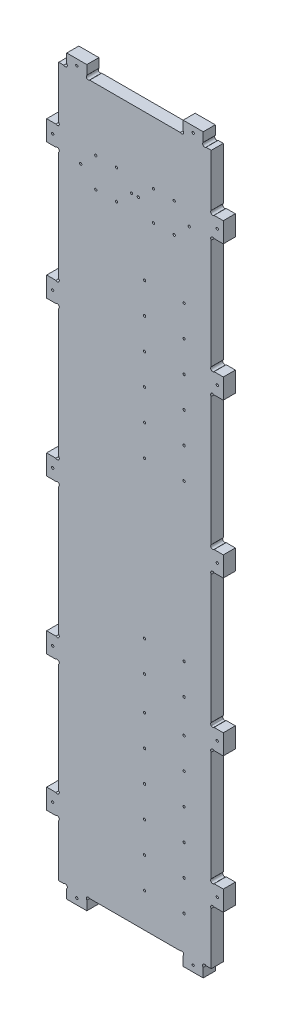
from build123d import *

# Parameters (mm, degrees)
SKETCH1_W            = 263.75
SKETCH1_H            = 1094.236516538
BOSS_EXTRUDE1_DEPTH  = 18
SKETCH2_W            = 18
SKETCH2_H            = 200
SKETCH2_H_2          = 172.118258269
CUT_EXTRUDE2_DEPTH   = 18
M3_CLEARANCE_HOLE1_D = 3.4
M3_CLEARANCE_HOLE2_D = 3.4
SKETCH7_R            = 3
CUT_EXTRUDE3_DEPTH   = 30


with BuildPart() as part:
    # Sketch1 → Boss-Extrude1 (new body)
    with BuildSketch(Plane.XY):
        with Locations((-43.875, 362.922706453)):
            Rectangle(SKETCH1_W, SKETCH1_H)
    extrude(amount=BOSS_EXTRUDE1_DEPTH)

    # Sketch2 → Cut-Extrude2 (cut)
    with BuildSketch(Plane(origin=(0, 0, 0), x_dir=(-1, 0, 0), z_dir=(0, 0, -1))):
        with Locations((166.75, 247.922706453)):
            Rectangle(SKETCH2_W, SKETCH2_H)
        Polygon((175.75, -184.195551816), (145.75, -184.195551816), (145.75, -166.195551816), (157.75, -166.195551816), (157.75, -84.195551816), (175.75, -84.195551816), align=None)
        Polygon((115.75, -166.195551816), (43.875, -166.195551816), (-28, -166.195551816), (-28, -184.195551816), (115.75, -184.195551816), align=None)
        with Locations((166.75, 31.863577318)):
            Rectangle(SKETCH2_W, SKETCH2_H_2)
        with Locations((-79, 247.922706453)):
            Rectangle(SKETCH2_W, SKETCH2_H)
        with Locations((-79, 31.863577318)):
            Rectangle(SKETCH2_W, SKETCH2_H_2)
        Polygon((-70, -84.195551816), (-88, -84.195551816), (-88, -184.195551816), (-58, -184.195551816), (-58, -166.195551816), (-70, -166.195551816), align=None)
        with Locations((-79, 477.922706453)):
            Rectangle(SKETCH2_W, SKETCH2_H)
        Polygon((-88, 910.040964722), (-58, 910.040964722), (-58, 892.040964722), (-70, 892.040964722), (-70, 810.040964722), (-88, 810.040964722), align=None)
        Polygon((-28, 892.040964722), (43.875, 892.040964722), (115.75, 892.040964722), (115.75, 910.040964722), (-28, 910.040964722), align=None)
        with Locations((-79, 693.981835587)):
            Rectangle(SKETCH2_W, SKETCH2_H_2)
        with Locations((166.75, 477.922706453)):
            Rectangle(SKETCH2_W, SKETCH2_H)
        with Locations((166.75, 693.981835587)):
            Rectangle(SKETCH2_W, SKETCH2_H_2)
        Polygon((157.75, 810.040964722), (175.75, 810.040964722), (175.75, 910.040964722), (145.75, 910.040964722), (145.75, 892.040964722), (157.75, 892.040964722), align=None)
    extrude(amount=-CUT_EXTRUDE2_DEPTH, mode=Mode.SUBTRACT)

    # M3 Clearance Hole1 (through all)
    with Locations(Plane.XY.offset(18)):
        with Locations((-38.848528137, 777.040964721), (-16.348528137, 799.165964719), (-16.348528137, 754.915964723), (14.651471863, 754.915964723), (14.651471863, 799.165964719), (37.151471863, 777.040964721), (79, 132.922706453), (79, 362.922706453), (79, 592.922706453), (79, 795.040964722), (79, -69.195551816), (43, -175.195551816), (43, 901.040964722), (-130.75, -175.195551816), (-166.75, -69.195551816), (-166.75, 795.040964722), (-166.75, 592.922706453), (-166.75, 362.922706453), (-166.75, 132.922706453), (-124.901471863, 777.040964721), (-102.401471863, 799.165964719), (-102.401471863, 754.915964723), (-71.401471863, 754.915964723), (-71.401471863, 799.165964719), (-48.901471863, 777.040964721), (-130.75, 901.040964722)):
            Hole(M3_CLEARANCE_HOLE1_D / 2)

    # M3 Clearance Hole2 (through all)
    with Locations(Plane(origin=(0, 0, 0), x_dir=(-1, 0, 0), z_dir=(0, 0, -1))):
        with Locations((-29.503, 536.133836003), (-29.503, 582.133836003), (29.503, 582.133836003), (29.503, 536.133836003), (29.503, -23), (29.503, 23), (-29.503, 23), (-29.503, -23), (-29.503, 444.133836003), (-29.503, 490.133836003), (29.503, 490.133836003), (29.503, 444.133836003), (29.503, -115), (29.503, -69), (-29.503, -69), (-29.503, -115), (-29.503, 628.133836003), (-29.503, 674.133836003), (29.503, 674.133836003), (29.503, 628.133836003), (29.503, 69), (29.503, 115), (-29.503, 115), (-29.503, 69), (29.503, 165), (29.503, 211), (-29.503, 211), (-29.503, 165)):
            Hole(M3_CLEARANCE_HOLE2_D / 2)

    # Sketch7 → Cut-Extrude3 (cut)
    with BuildSketch(Plane.XY.offset(18)):
        with Locations((-147.871320344, -168.31687216)):
            Circle(SKETCH7_R)
        with Locations((-113.616734002, -168.304858855)):
            Circle(SKETCH7_R)
        with Locations((25.866734002, -168.304858855)):
            Circle(SKETCH7_R)
        with Locations((60.121320344, -168.31687216)):
            Circle(SKETCH7_R)
        with Locations((60.121320344, 894.162285065)):
            Circle(SKETCH7_R)
        with Locations((25.866734002, 894.15027176)):
            Circle(SKETCH7_R)
        with Locations((-113.616734002, 894.15027176)):
            Circle(SKETCH7_R)
        with Locations((-147.871320344, 894.162285065)):
            Circle(SKETCH7_R)
        with Locations((72.121320344, 812.162285065)):
            Circle(SKETCH7_R)
        with Locations((72.121320344, 777.919644378)):
            Circle(SKETCH7_R)
        with Locations((72.121320344, 610.042285065)):
            Circle(SKETCH7_R)
        with Locations((72.121320344, 575.799644378)):
            Circle(SKETCH7_R)
        with Locations((72.121320344, 150.045768527)):
            Circle(SKETCH7_R)
        with Locations((72.121320344, 115.80312784)):
            Circle(SKETCH7_R)
        with Locations((72.121320344, -52.074231473)):
            Circle(SKETCH7_R)
        with Locations((72.121320344, -86.31687216)):
            Circle(SKETCH7_R)
        with Locations((72.121320344, 380.044026796)):
            Circle(SKETCH7_R)
        with Locations((72.121320344, 345.801386109)):
            Circle(SKETCH7_R)
        with Locations((-159.871320344, 345.801386109)):
            Circle(SKETCH7_R)
        with Locations((-159.871320344, 380.044026796)):
            Circle(SKETCH7_R)
        with Locations((-159.871320344, -86.31687216)):
            Circle(SKETCH7_R)
        with Locations((-159.871320344, -52.074231473)):
            Circle(SKETCH7_R)
        with Locations((-159.871320344, 115.80312784)):
            Circle(SKETCH7_R)
        with Locations((-159.871320344, 150.045768527)):
            Circle(SKETCH7_R)
        with Locations((-159.871320344, 575.799644378)):
            Circle(SKETCH7_R)
        with Locations((-159.871320344, 610.042285065)):
            Circle(SKETCH7_R)
        with Locations((-159.871320344, 777.919644378)):
            Circle(SKETCH7_R)
        with Locations((-159.871320344, 812.162285065)):
            Circle(SKETCH7_R)
    extrude(amount=-CUT_EXTRUDE3_DEPTH, mode=Mode.SUBTRACT)


solid = part.part
